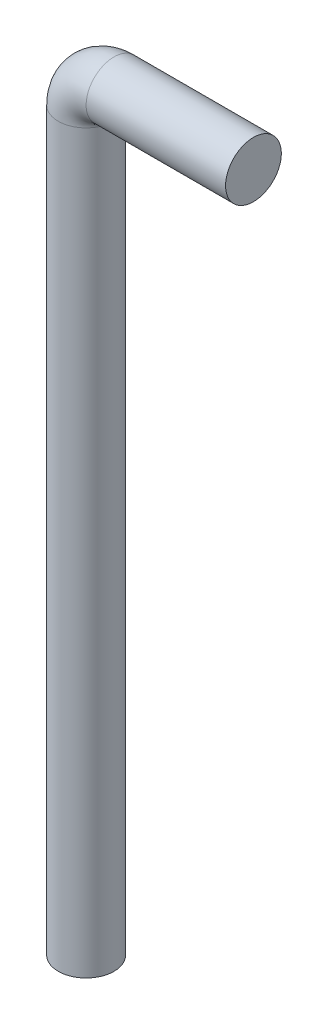
from build123d import *

# Parameters (mm, degrees)
SKETCH_2_R      = 2.5
EXTRUDE_1_DEPTH = 66
SKETCH_6_R      = 2.5


with BuildPart() as part:
    # 草图2 → 凸台-拉伸1 (new body)
    with BuildSketch(Plane(origin=(0, 0, 0), x_dir=(1, 0, 0), z_dir=(0, 1, 0))):
        with Locations(Location((0, 0, 0), (0, 0, 270))):
            Circle(SKETCH_2_R)
    extrude(amount=EXTRUDE_1_DEPTH)

    # 扫描1: sweep along a path in 草图5
    with BuildLine(Plane.XY) as sweep_1_path:
        Line((15, 68.5), (2.5, 68.5))
        ThreePointArc((2.5, 68.5), (0.732233047, 67.767766953), (0, 66))
    # 草图6 → 扫描1 (sweep)
    with BuildSketch(Plane(origin=(0, 66, 0), x_dir=(1, 0, 0), z_dir=(0, 1, 0))):
        Circle(SKETCH_6_R)
    sweep(path=sweep_1_path.line)


solid = part.part
